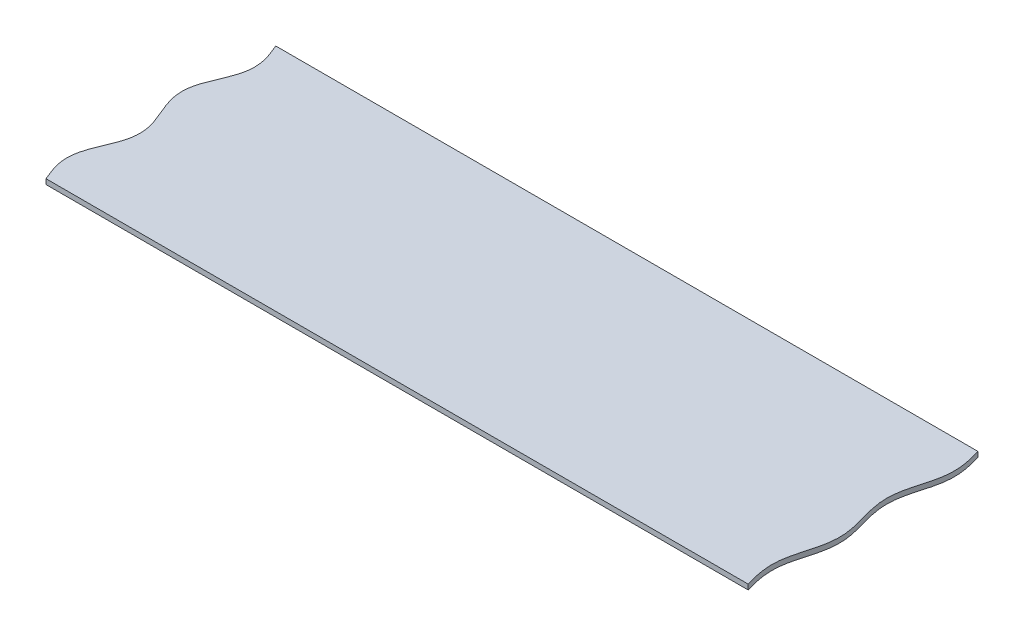
from build123d import *

# Parameters (mm, degrees)
BOSS_EXTRUDE1_DEPTH = 0.4


with BuildPart() as part:
    # Sketch1 → Boss-Extrude1 (new body)
    with BuildSketch(Plane(origin=(0, 0, 0), x_dir=(1, 0, 0), z_dir=(0, 1, 0))):
        with BuildLine():
            Line((0, 0), (55, 0))
            add(Edge.make_bspline(
                [(55, 0), (55.033262254, -0.11910992), (55.082991541, -0.297189427), (55.189772351, -0.69095155), (55.257898591, -0.997698602), (55.325744816, -1.336345897), (55.368877768, -1.648938844), (55.398888986, -1.994468715), (55.403875393, -2.331105954), (55.387597755, -2.672397061), (55.344466555, -3.051244756), (55.269643322, -3.469311628), (55.151200158, -3.964185261), (54.990401734, -4.536028524), (54.817141498, -5.150727725), (54.667523026, -5.816335608), (54.587580107, -6.495028261), (54.600388862, -7.223123132), (54.742130419, -8.108654486), (55.002450481, -9.007873921), (55.261734401, -9.907459056), (55.401315475, -10.790521339), (55.412936347, -11.513899459), (55.332704186, -12.19014491), (55.183645522, -12.853043473), (55.01119991, -13.465115176), (54.850570507, -14.036186493), (54.732045155, -14.53063447), (54.657008519, -14.948661692), (54.613640075, -15.327481905), (54.59713117, -15.668761216), (54.601881624, -16.005402716), (54.63167005, -16.350951124), (54.674614398, -16.66357237), (54.742311673, -17.002247722), (54.810304458, -17.309028986), (54.917025725, -17.702804036), (54.966737826, -17.88089003), (55, -18)],
                knots=[0.082954934, 0.082954934, 0.082954934, 0.082954934, 0.082954934, 0.109918584, 0.12340041, 0.136882236, 0.152330914, 0.167779593, 0.183228217, 0.198676842, 0.214125488, 0.229574134, 0.252675637, 0.27577714, 0.306674483, 0.337571825, 0.368826832, 0.399724073, 0.430621367, 0.469600647, 0.53139537, 0.56987402, 0.600771291, 0.631668595, 0.662565916, 0.693391747, 0.724217578, 0.747319081, 0.770420585, 0.785869231, 0.801317877, 0.816766502, 0.832215126, 0.847663804, 0.863112482, 0.876594308, 0.890076134, 0.917039786, 0.917039786, 0.917039786, 0.917039786, 0.917039786], degree=4))
            Line((55, -18), (0, -18))
            add(Edge.make_bspline(
                [(0, 0), (0.049449566, -0.118048236), (0.111116121, -0.265261767), (0.230875713, -0.558055111), (0.313966248, -0.78653977), (0.362563048, -0.927516596), (0.424573498, -1.120266976), (0.492346834, -1.361576076), (0.554441877, -1.649698324), (0.592274908, -1.949406714), (0.603031319, -2.206899085), (0.596617784, -2.46474337), (0.573067652, -2.7216697), (0.514178041, -3.063998966), (0.399297623, -3.48531299), (0.25089524, -3.895665746), (0.085536401, -4.299154578), (-0.099590356, -4.737446397), (-0.296840696, -5.220718922), (-0.493648556, -5.796953023), (-0.618973463, -6.483449136), (-0.599627972, -7.232066465), (-0.381223591, -8.120124004), (-5.5686e-05, -9.00003028), (0.381336688, -9.879808571), (0.600500416, -10.767651071), (0.620704458, -11.51624215), (0.496048404, -12.202876161), (0.299570119, -12.779233487), (0.102439222, -13.262553413), (-0.082685047, -13.700851056), (-0.248137811, -14.104290103), (-0.396725969, -14.51459272), (-0.511937812, -14.935780978), (-0.578462018, -15.320493582), (-0.60487923, -15.663626876), (-0.59632784, -16.00799493), (-0.554022381, -16.349164286), (-0.483044582, -16.677374827), (-0.392947327, -16.98805117), (-0.286122, -17.293418434), (-0.184743293, -17.556083772), (-0.074093584, -17.823098462), (-0.024724736, -17.940975828), (0, -18)],
                knots=[0.08332238, 0.08332238, 0.08332238, 0.08332238, 0.08332238, 0.11060458, 0.117425131, 0.124245681, 0.131066232, 0.137886783, 0.153149398, 0.168412013, 0.183674669, 0.191305997, 0.198937325, 0.214200036, 0.229462748, 0.25292918, 0.276395612, 0.29165835, 0.306921087, 0.337446562, 0.369116698, 0.399642007, 0.430167333, 0.469468854, 0.53051982, 0.569821341, 0.600346668, 0.630871977, 0.662542111, 0.693067587, 0.708330324, 0.723593062, 0.747059493, 0.770525924, 0.785788637, 0.801051349, 0.816314005, 0.83157666, 0.846839275, 0.862101891, 0.875742992, 0.889384094, 0.903025196, 0.916666297, 0.916666297, 0.916666297, 0.916666297, 0.916666297], degree=4))
        make_face()
    extrude(amount=BOSS_EXTRUDE1_DEPTH)


solid = part.part
